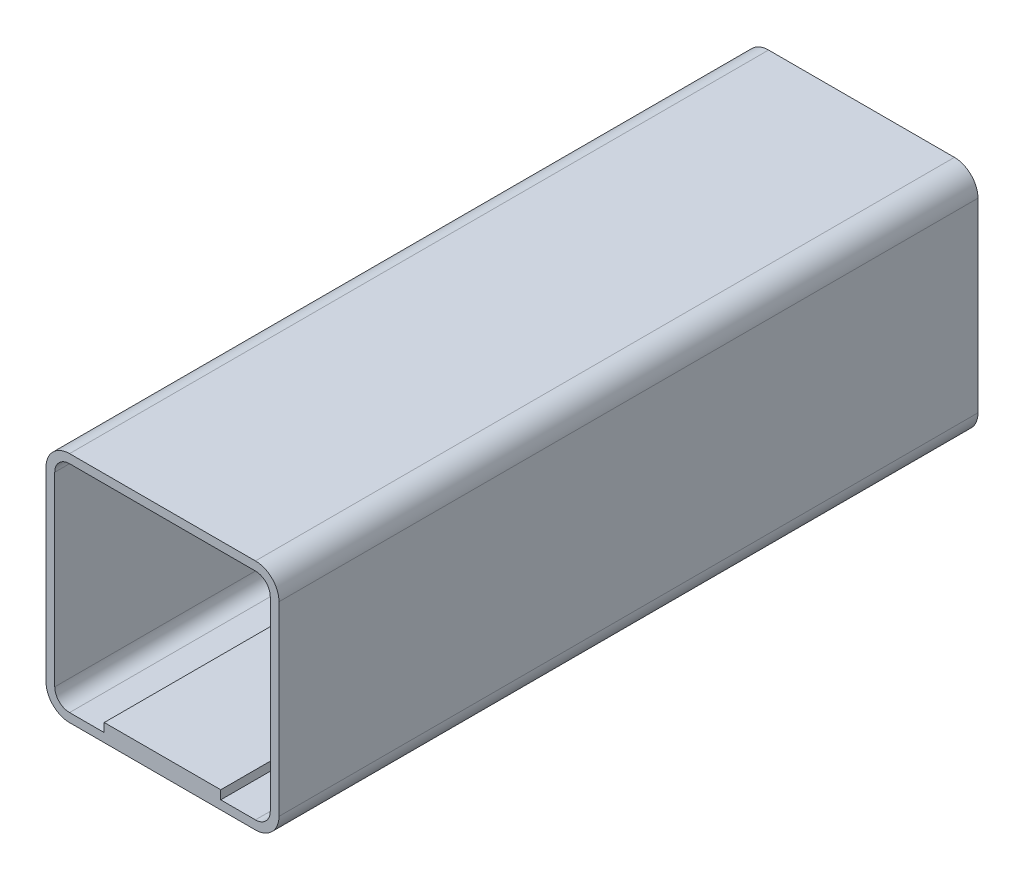
from build123d import *

# Parameters (mm, degrees)
BOSS_EXTRUDE1_DEPTH = 381
SHELL1_T            = -4.7625
SKETCH3_W           = 63.5
SKETCH3_H           = 4.7625
BOSS_EXTRUDE2_DEPTH = 381


with BuildPart() as part:
    # Sketch1 → Boss-Extrude1 (new body)
    with BuildSketch(Plane.XY):
        with BuildLine():
            Line((-50.652428891, 63.5), (50.652428891, 63.5))
            ThreePointArc((50.652428891, 63.5), (59.737033544, 59.737033544), (63.5, 50.652428891))
            Line((63.5, 50.652428891), (63.5, -50.652428891))
            ThreePointArc((63.5, -50.652428891), (59.737033544, -59.737033544), (50.652428891, -63.5))
            Line((50.652428891, -63.5), (-50.652428891, -63.5))
            ThreePointArc((-50.652428891, -63.5), (-59.737033544, -59.737033544), (-63.5, -50.652428891))
            Line((-63.5, -50.652428891), (-63.5, 50.652428891))
            ThreePointArc((-63.5, 50.652428891), (-59.737033544, 59.737033544), (-50.652428891, 63.5))
        make_face()
    extrude(amount=-BOSS_EXTRUDE1_DEPTH)

    # Shell1
    shell1_openings = [part.faces().sort_by_distance(p)[0] for p in [
        (0, 0, -381),
        (0, 0, 0),
    ]]
    offset(amount=SHELL1_T, openings=shell1_openings, kind=Kind.INTERSECTION)

    # Sketch3 → Boss-Extrude2 (add)
    with BuildSketch(Plane.XY):
        with Locations((0, -56.35625)):
            Rectangle(SKETCH3_W, SKETCH3_H)
    extrude(amount=-BOSS_EXTRUDE2_DEPTH)


solid = part.part
